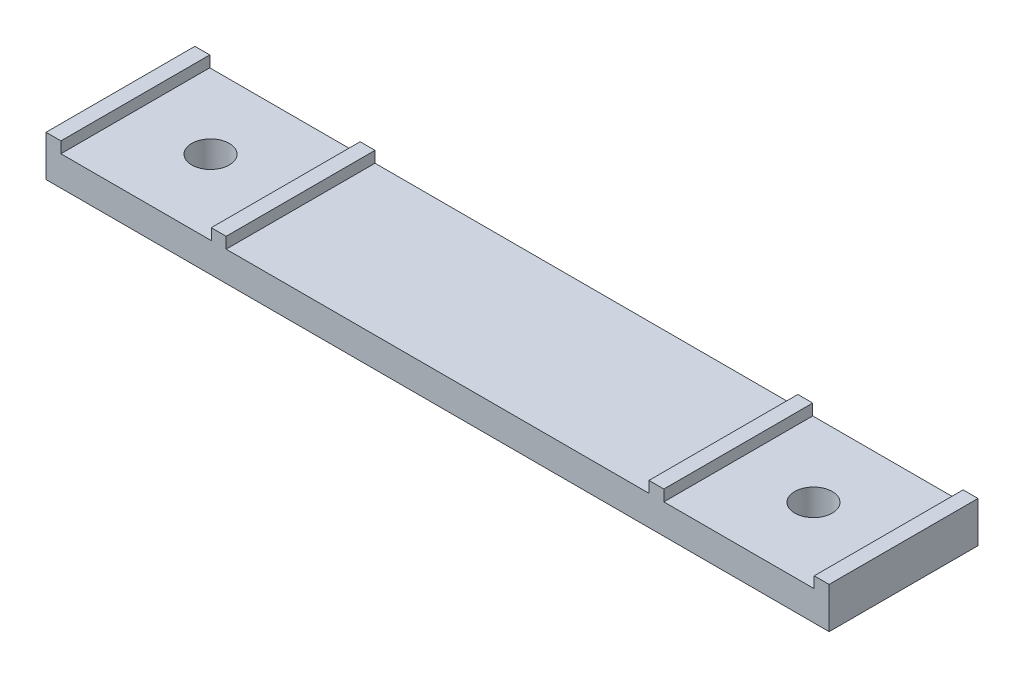
from build123d import *

# Parameters (mm, degrees)
BOSS_EXTRUDE1_DEPTH = 25.4
SKETCH3_R           = 3.2004
CUT_EXTRUDE1_DEPTH  = 25.4


with BuildPart() as part:
    # Sketch2 → Boss-Extrude1 (new body)
    with BuildSketch(Plane.XY):
        Polygon((66.802, 0), (-66.802, 0), (-66.802, 6.985), (-64.262, 6.985), (-64.262, 5.08), (-38.608, 5.08), (-38.608, 6.985), (-36.068, 6.985), (-36.068, 5.08), (36.068, 5.08), (36.068, 6.985), (38.608, 6.985), (38.608, 5.08), (64.262, 5.08), (64.262, 6.985), (66.802, 6.985), align=None)
    extrude(amount=BOSS_EXTRUDE1_DEPTH)

    # Sketch3 → Cut-Extrude1 (cut)
    with BuildSketch(Plane(origin=(0, 5.08, 0), x_dir=(1, 0, 0), z_dir=(0, 1, 0))):
        with Locations(Location((-51.435, -12.7, 0), (0, 0, 270))):
            Circle(SKETCH3_R)
        with Locations(Location((51.435, -12.7, 0), (0, 0, 270))):
            Circle(SKETCH3_R)
    extrude(amount=-CUT_EXTRUDE1_DEPTH, mode=Mode.SUBTRACT)


solid = part.part
